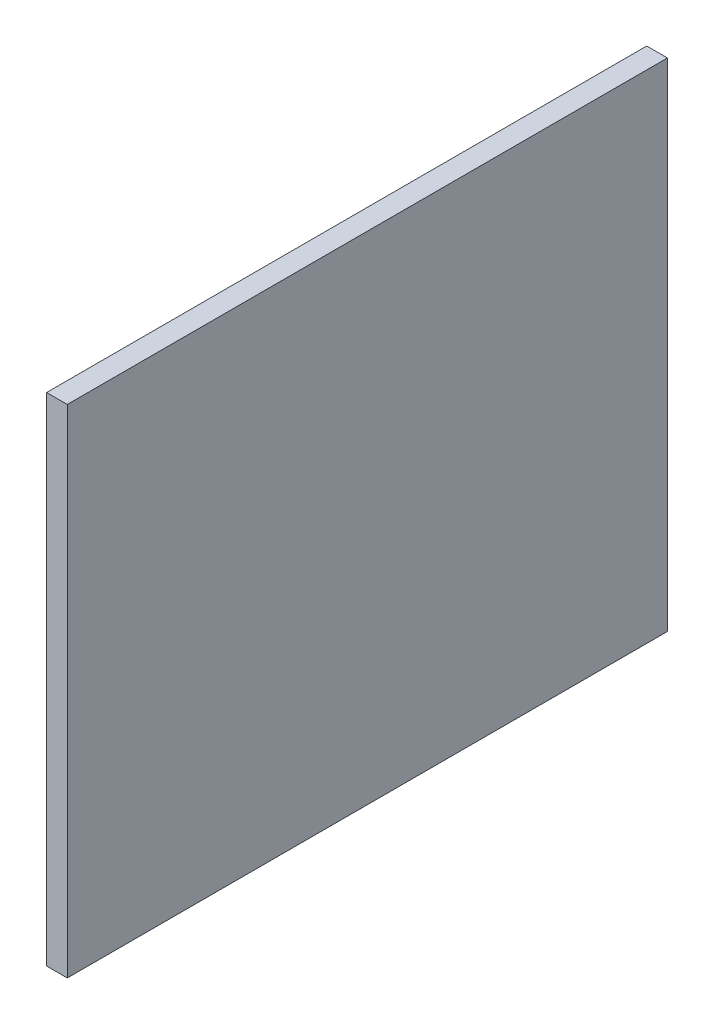
from build123d import *

# Parameters (mm, degrees)
SKETCH1_W           = 87
SKETCH1_H           = 72
BOSS_EXTRUDE1_DEPTH = 3


with BuildPart() as part:
    # Sketch1 → Boss-Extrude1 (new body)
    with BuildSketch(Plane(origin=(0, 0, 0), x_dir=(0, 0, -1), z_dir=(1, 0, 0))):
        with Locations((23.213286713, -3.787088341)):
            Rectangle(SKETCH1_W, SKETCH1_H)
    extrude(amount=BOSS_EXTRUDE1_DEPTH)


solid = part.part
